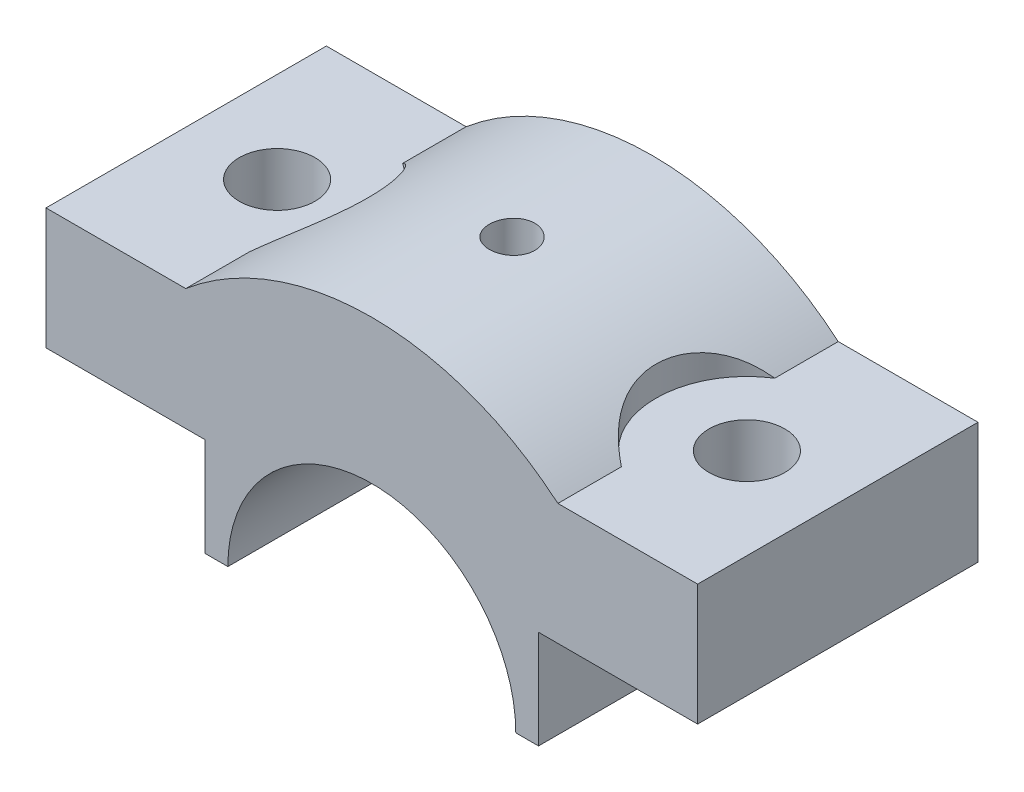
from build123d import *

# Parameters (mm, degrees)
BOSS_EXTRUDE1_DEPTH = 37
SKETCH3_R           = 5
CUT_EXTRUDE1_DEPTH  = 37
SKETCH4_R           = 12
CUT_EXTRUDE2_DEPTH  = 12
SKETCH5_R           = 2
CUT_EXTRUDE3_DEPTH  = 50
SKETCH6_R           = 3
CUT_EXTRUDE4_DEPTH  = 29


with BuildPart() as part:
    # Sketch1 → Boss-Extrude1 (new body)
    with BuildSketch(Plane.XY):
        with BuildLine():
            Line((-19, 0), (-22, 0))
            Line((-22, 0), (-22, 13))
            Line((-22, 13), (-43, 13))
            Line((-43, 13), (-43, 29))
            Line((-43, 29), (-24.556058316, 29))
            ThreePointArc((-24.556058316, 29), (0, 38), (24.556058316, 29))
            Line((24.556058316, 29), (43, 29))
            Line((43, 29), (43, 13))
            Line((43, 13), (22, 13))
            Line((22, 13), (22, 0))
            Line((22, 0), (19, 0))
            ThreePointArc((19, 0), (0, 19), (-19, 0))
        make_face()
    extrude(amount=BOSS_EXTRUDE1_DEPTH)

    # Sketch3 → Cut-Extrude1 (cut)
    with BuildSketch(Plane(origin=(0, 29, 0), x_dir=(1, 0, 0), z_dir=(0, 1, 0))):
        with Locations(Location((-31, -18.5, 0), (0, 0, 270))):
            Circle(SKETCH3_R)
        with Locations(Location((31, -18.5, 0), (0, 0, 180))):
            Circle(SKETCH3_R)
    extrude(amount=-CUT_EXTRUDE1_DEPTH, mode=Mode.SUBTRACT)

    # Sketch4 → Cut-Extrude2 (cut)
    with BuildSketch(Plane(origin=(0, 29, 0), x_dir=(1, 0, 0), z_dir=(0, 1, 0))):
        with Locations((-31, -18.5)):
            Circle(SKETCH4_R)
        with Locations((31, -18.5)):
            Circle(SKETCH4_R)
    extrude(amount=CUT_EXTRUDE2_DEPTH, mode=Mode.SUBTRACT)

    # Sketch5 → Cut-Extrude3 (cut)
    with BuildSketch(Plane(origin=(0, 0, 0), x_dir=(1, 0, 0), z_dir=(0, 1, 0))):
        with Locations(Location((0, -18.5, 0), (0, 0, 90))):
            Circle(SKETCH5_R)
    extrude(amount=CUT_EXTRUDE3_DEPTH, mode=Mode.SUBTRACT)

    # Sketch6 → Cut-Extrude4 (cut)
    with BuildSketch(Plane(origin=(0, 25, 0), x_dir=(1, 0, 0), z_dir=(0, 1, 0))):
        with Locations(Location((0, -18.5, 0), (0, 0, 90))):
            Circle(SKETCH6_R)
    extrude(amount=CUT_EXTRUDE4_DEPTH, mode=Mode.SUBTRACT)


solid = part.part
